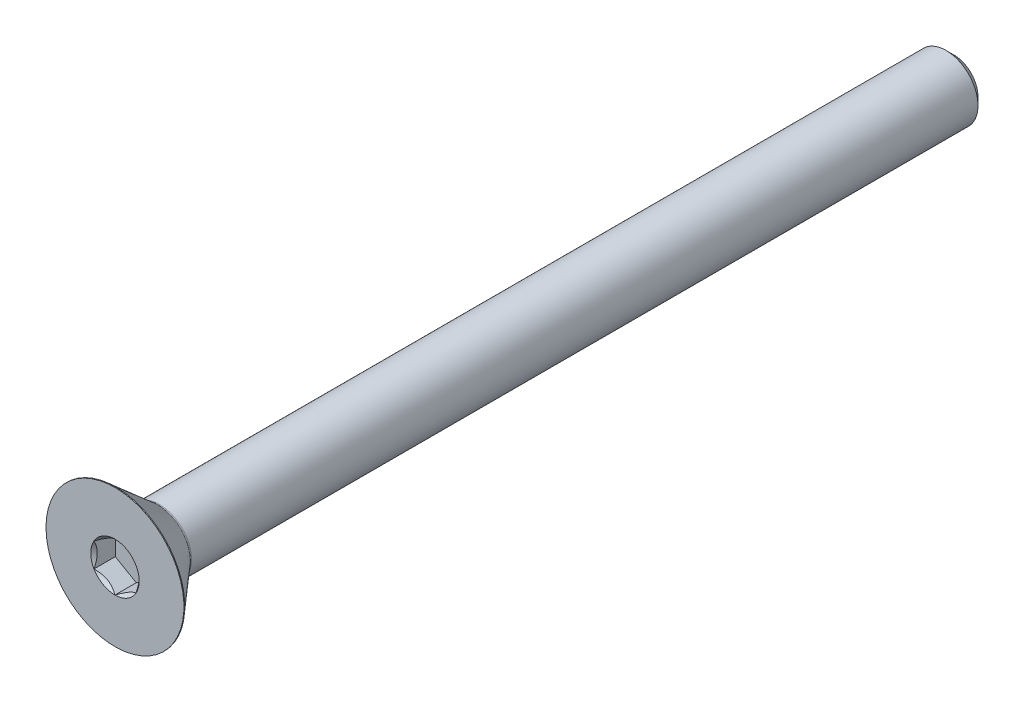
from build123d import *

# Parameters (mm, degrees)
SKETCH10_R         = 1.833087105
CUT_EXTRUDE2_DEPTH = 1.6129
CUT_EXTRUDE2_DRAFT = -45
CUT_EXTRUDE1_DEPTH = 1.6129


with BuildPart() as part:
    # Sketch2 → Revolve1 (revolve)
    with BuildSketch(Plane(origin=(0, 0, 0), x_dir=(0, 0, -1), z_dir=(1, 0, 0)), mode=Mode.PRIVATE) as revolve1_sk:
        with BuildLine():
            Line((-31.685484, 5.2197), (-28.5242, 2.471637744))
            ThreePointArc((-28.5242, 2.471637744), (-28.45108483, 2.428138789), (-28.367366229, 2.413))
            Line((-28.367366229, 2.413), (31.1546875, 2.413))
            Line((31.1546875, 2.413), (31.75, 1.8176875))
            Line((31.75, 1.8176875), (31.75, 0))
            Line((31.75, 0), (-31.75, 0))
            Line((-31.75, 0), (-31.75, 5.2197))
            Line((-31.75, 5.2197), (-31.685484, 5.2197))
        make_face()
    revolve(revolve1_sk.sketch.rotate(Axis((0, 0, -31.75), (0, 0, 1)), 90), axis=Axis((0, 0, -31.75), (0, 0, 1)))


with BuildPart() as cut_extrude2_tool:
    # Sketch10 → Cut-Extrude2 (with draft: the straight prism first)
    with BuildSketch(Plane.XY.offset(31.75)):
        Circle(SKETCH10_R)
    extrude(amount=-CUT_EXTRUDE2_DEPTH)
    # Cut-Extrude2: the draft: its side faces are tilted about the plane it starts from
    cut_extrude2_sides = [cut_extrude2_tool.faces().sort_by_distance(p)[0] for p in [
        (-1.833087105, 0, 30.94355),
    ]]
    draft(cut_extrude2_sides, Plane.XY.offset(31.75), CUT_EXTRUDE2_DRAFT)


with BuildPart() as part_1:
    add(part.part)

    # Cut-Extrude2: cut by cut_extrude2_tool
    add(cut_extrude2_tool.part, mode=Mode.SUBTRACT)

    # Sketch9 → Cut-Extrude1 (cut)
    with BuildSketch(Plane.XY.offset(31.75)):
        Polygon((1.5875, -0.916543552), (1.5875, 0.916543552), (0, 1.833087105), (-1.5875, 0.916543552), (-1.5875, -0.916543552), (0, -1.833087105), align=None)
    extrude(amount=-CUT_EXTRUDE1_DEPTH, mode=Mode.SUBTRACT)


solid = part_1.part
